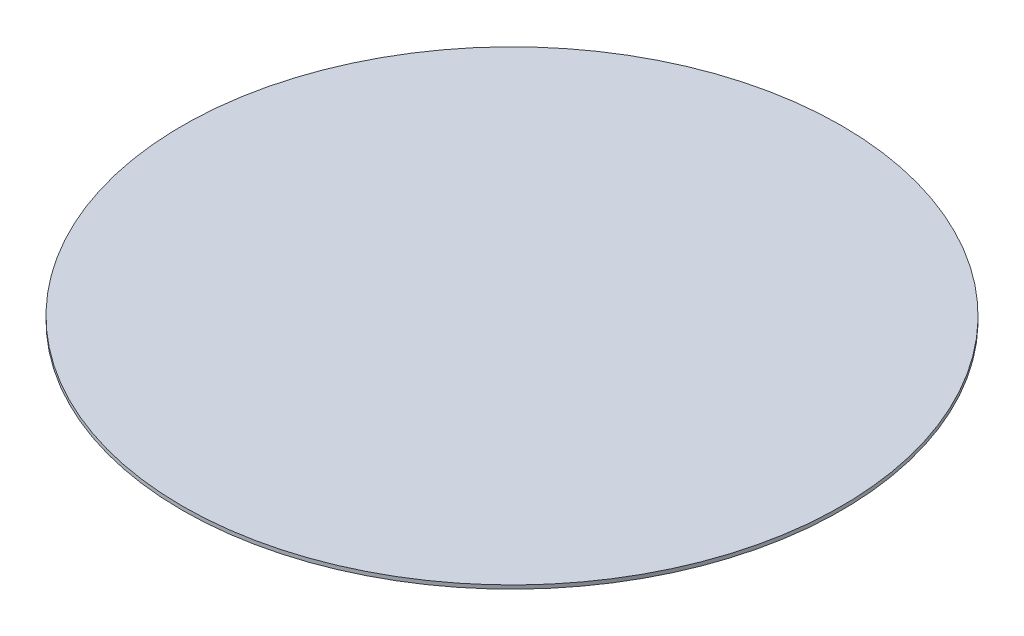
from build123d import *

# Parameters (mm, degrees)
SKETCH1_R           = 57.15
BOSS_EXTRUDE1_DEPTH = 0.635


with BuildPart() as part:
    # Sketch1 → Boss-Extrude1 (new body)
    with BuildSketch(Plane(origin=(0, 0, 0), x_dir=(1, 0, 0), z_dir=(0, 1, 0))):
        with Locations(Location((0, 0, 0), (0, 0, 270))):
            Circle(SKETCH1_R)
    extrude(amount=BOSS_EXTRUDE1_DEPTH)


solid = part.part
